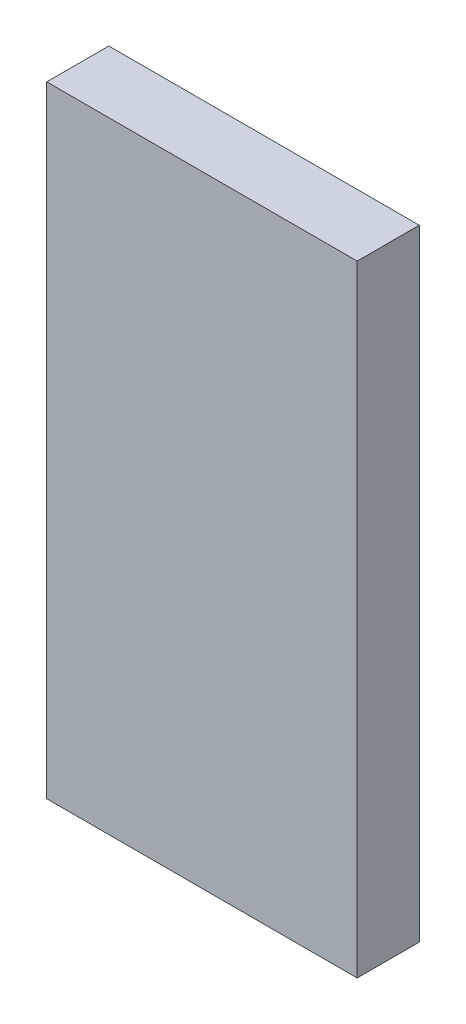
from build123d import *

# Parameters (mm, degrees)
CROQUIS1_W              = 60
CROQUIS1_H              = 120
SALIENTE_EXTRUIR1_DEPTH = 12


with BuildPart() as part:
    # Croquis1 → Saliente-Extruir1 (new body)
    with BuildSketch(Plane.XY):
        Rectangle(CROQUIS1_W, CROQUIS1_H)
    extrude(amount=SALIENTE_EXTRUIR1_DEPTH)


solid = part.part
